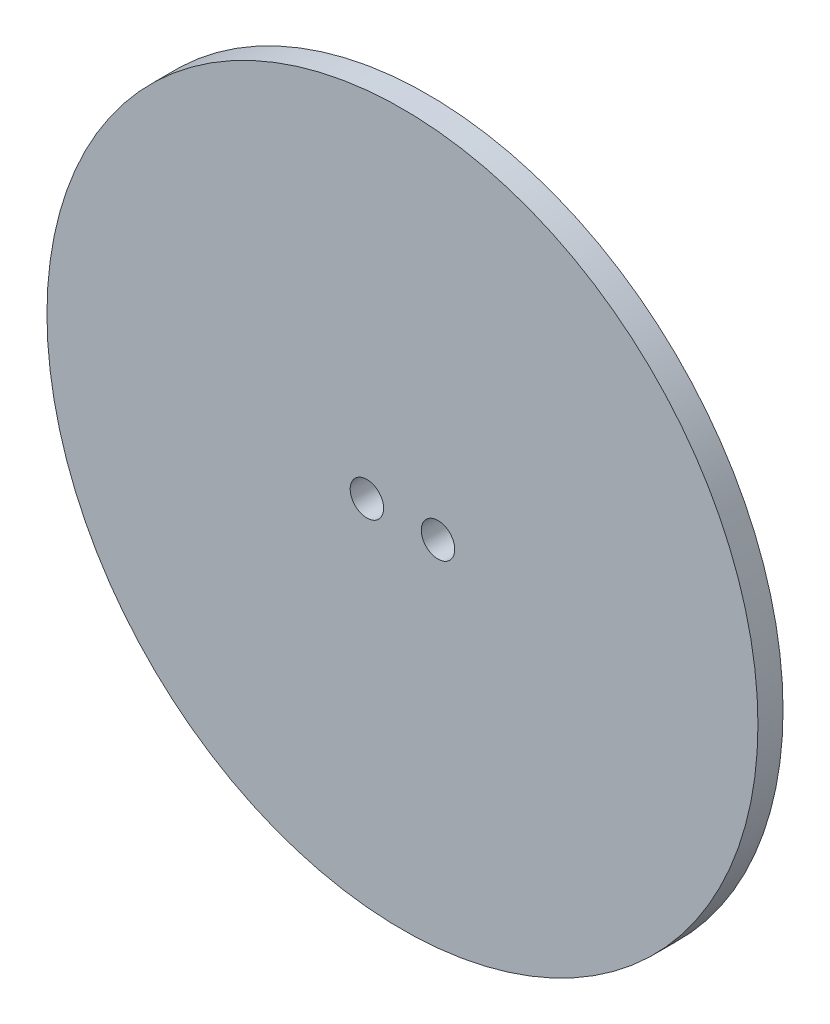
from build123d import *

# Parameters (mm, degrees)
SKETCH_1_R          = 42.5
EXTRUDE_1_DEPTH     = 3
CUT_EXTRUDE_1_REACH = 62.179
SKETCH_2_R          = 2


with BuildPart() as part:
    # 草图1 → 凸台-拉伸1 (new body)
    with BuildSketch(Plane.XY):
        Circle(SKETCH_1_R)
    extrude(amount=EXTRUDE_1_DEPTH)

    # 草图2 → 切除-拉伸1 (cut, up to next)
    with BuildSketch(Plane(origin=(0, 0, 0), x_dir=(-1, 0, 0), z_dir=(0, 0, -1)), mode=Mode.PRIVATE) as cut_extrude_1_sk1:
        with Locations((4.25, 0)):
            Circle(SKETCH_2_R)
    cut_extrude_1_tool1 = extrude(cut_extrude_1_sk1.sketch, amount=-CUT_EXTRUDE_1_REACH, mode=Mode.PRIVATE) & part.part
    # 草图2 → 切除-拉伸1 (cut, up to next)
    with BuildSketch(Plane(origin=(0, 0, 0), x_dir=(-1, 0, 0), z_dir=(0, 0, -1)), mode=Mode.PRIVATE) as cut_extrude_1_sk2:
        with Locations((-4.25, 0)):
            Circle(SKETCH_2_R)
    cut_extrude_1_tool2 = extrude(cut_extrude_1_sk2.sketch, amount=-CUT_EXTRUDE_1_REACH, mode=Mode.PRIVATE) & part.part
    add(cut_extrude_1_tool1.solids().sort_by_distance((-4.25, 0, 0))[0], mode=Mode.SUBTRACT)
    add(cut_extrude_1_tool2.solids().sort_by_distance((4.25, 0, 0))[0], mode=Mode.SUBTRACT)


solid = part.part
